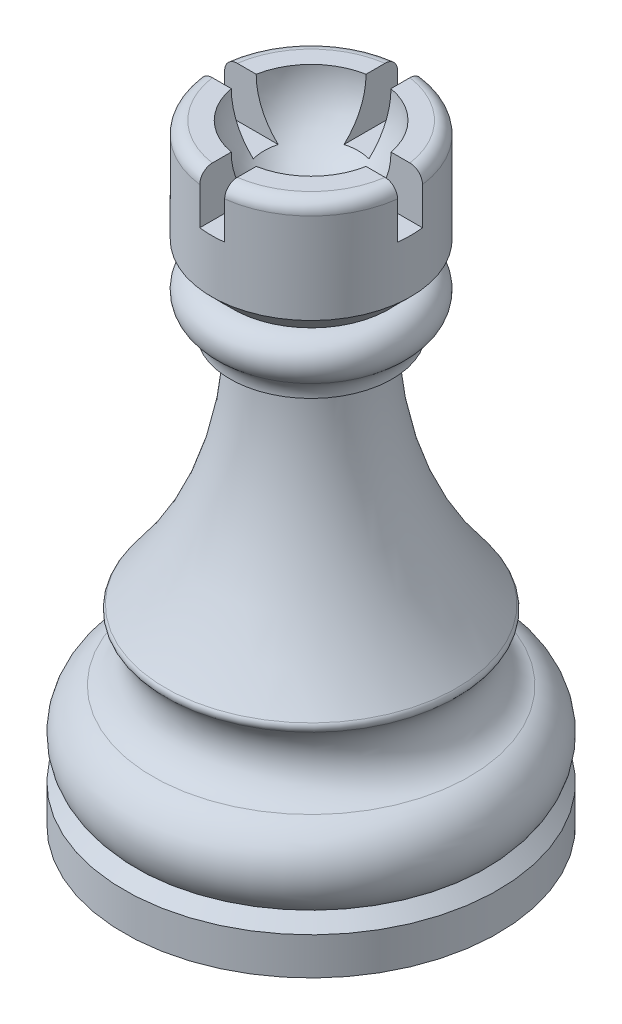
from build123d import *

# Parameters (mm, degrees)
CUT_EXTRUDE1_DEPTH      = 10
CUT_EXTRUDE1_DEPTH_BACK = 10
SKETCH2_W               = 2
SKETCH2_H               = 4
CUT_EXTRUDE2_DEPTH      = 10
CUT_EXTRUDE2_DEPTH_BACK = 10
SKETCH3_W               = 2
SKETCH3_H               = 4


with BuildPart() as part:
    # Sketch1 → Revolve2 (revolve)
    with BuildSketch(Plane(origin=(0, 0, 0), x_dir=(0, 0, -1), z_dir=(1, 0, 0))):
        with BuildLine():
            Line((0, 0), (0, 43.5))
            ThreePointArc((0, 43.5), (3.889087297, 45.110912703), (5.5, 49))
            Line((5.5, 49), (7, 49))
            ThreePointArc((7, 49), (7.707106781, 48.707106781), (8, 48))
            Line((8, 48), (8, 40.740342281))
            Line((8, 40.740342281), (6.259657719, 39))
            ThreePointArc((6.259657719, 39), (7.911046112, 37.808936912), (7.302065633, 35.866037615))
            ThreePointArc((7.302065633, 35.866037615), (6.711723073, 35.160071642), (6.5, 34.264490471))
            Line((6.5, 34.264490471), (5, 34))
            ThreePointArc((5, 34), (6.720923384, 24.108823943), (11.681439478, 15.380122942))
            ThreePointArc((11.681439478, 15.380122942), (11.794752053, 15.034650824), (11.644085453, 14.703757639))
            ThreePointArc((11.644085453, 14.703757639), (10.801526231, 11.927129433), (12.703742165, 9.73597796))
            ThreePointArc((12.703742165, 9.73597796), (14.91391085, 7.220990038), (14, 4))
            Line((14, 4), (15, 3))
            Line((15, 3), (15, 0))
            Line((15, 0), (0, 0))
        make_face()
    revolve(axis=Axis((0, 0, 0), (0, 1, 0)))

    # Sketch2 → Cut-Extrude1 (cut, two sides: drawn at the far end of the back side and taken through both)
    with BuildSketch(Plane(origin=(0, 0, 0), x_dir=(0, 0, -1), z_dir=(1, 0, 0)).offset(-CUT_EXTRUDE1_DEPTH_BACK)):
        with Locations((0, 47)):
            Rectangle(SKETCH2_W, SKETCH2_H)
    extrude(amount=CUT_EXTRUDE1_DEPTH + CUT_EXTRUDE1_DEPTH_BACK, mode=Mode.SUBTRACT)

    # Sketch3 → Cut-Extrude2 (cut, two sides: drawn at the far end of the back side and taken through both)
    with BuildSketch(Plane.XY.offset(-CUT_EXTRUDE2_DEPTH_BACK)):
        with Locations((0, 47)):
            Rectangle(SKETCH3_W, SKETCH3_H)
    extrude(amount=CUT_EXTRUDE2_DEPTH + CUT_EXTRUDE2_DEPTH_BACK, mode=Mode.SUBTRACT)


solid = part.part
